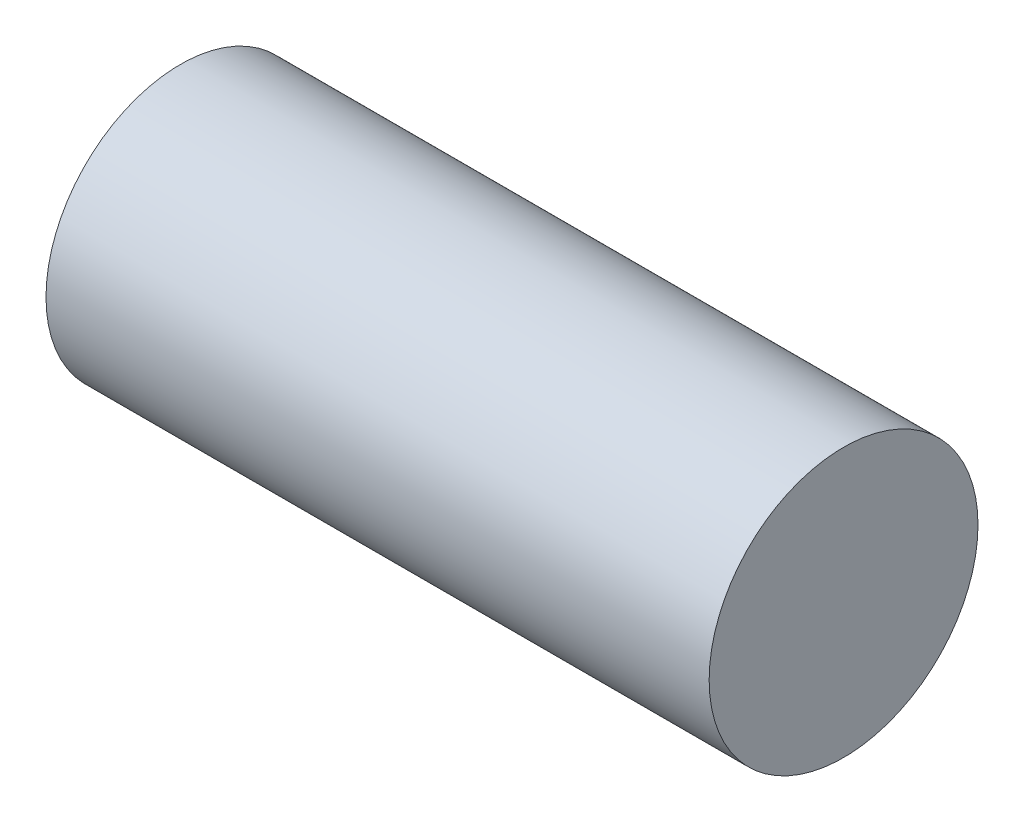
from build123d import *

# Parameters (mm, degrees)
PIN_PROFILE_R     = 15
PIN_EXTRUDE_DEPTH = 74


with BuildPart() as part:
    # Pin Profile → Pin Extrude (new body)
    with BuildSketch(Plane(origin=(0, 0, 0), x_dir=(0, 0, -1), z_dir=(1, 0, 0))):
        Circle(PIN_PROFILE_R)
    extrude(amount=-PIN_EXTRUDE_DEPTH)


solid = part.part
